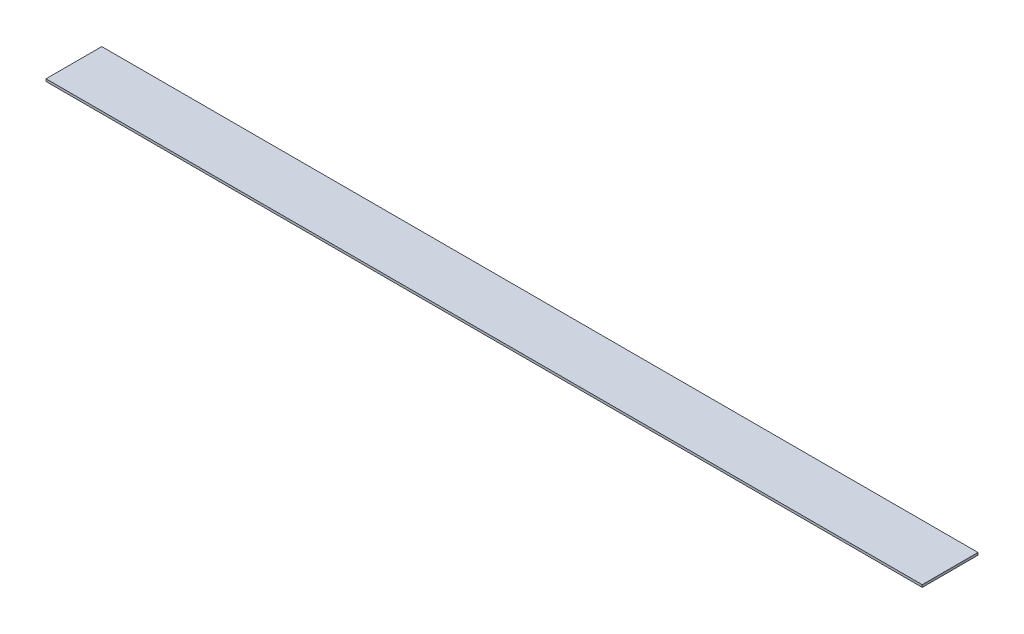
from build123d import *

# Parameters (mm, degrees)
CROQUIS1_W     = 1100
CROQUIS1_H     = 70
EXTRUIR1_DEPTH = 3


with BuildPart() as part:
    # Croquis1 → Extruir1 (new body)
    with BuildSketch(Plane(origin=(0, 0, 0), x_dir=(1, 0, 0), z_dir=(0, 1, 0))):
        Rectangle(CROQUIS1_W, CROQUIS1_H)
    extrude(amount=EXTRUIR1_DEPTH)


solid = part.part
